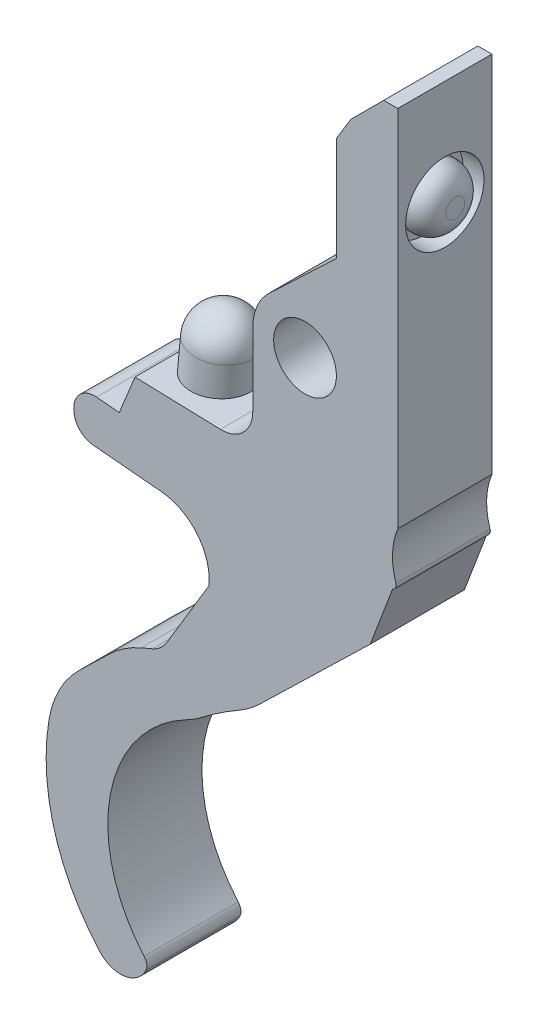
from build123d import *

# Parameters (mm, degrees)
SKETCH_1_R          = 5
SKETCH_1_R_2        = 3
EXTRUDE_1_DEPTH     = 9
SKETCH_2_R          = 3.75
CUT_EXTRUDE_1_DEPTH = 2
SKETCH_3_R          = 2.9
EXTRUDE_2_DEPTH     = 3
FILLET_1_R          = 2
SKETCH_4_R          = 2.9
EXTRUDE_3_DEPTH     = 10
FILLET_2_R          = 2.9
FILLET_3_R          = 3


with BuildPart() as part:
    # 스케치1 → 보스-돌출1 (new body)
    # profile 1 of 5: a face of its own
    with BuildSketch(Plane.XY):
        with BuildLine():
            Line((8.866410343, 21.94338903), (4.384187039, 21.94338903))
            Line((4.384187039, 21.94338903), (2.987768149, 19.65002342))
            Line((2.987768149, 19.65002342), (2.987768149, 17.661246793))
            Line((2.987768149, 17.661246793), (2.987768149, 9.70876495))
            Line((2.987768149, 9.70876495), (-3.184671245, 3.854590647))
            ThreePointArc((-3.184671245, 3.854590647), (2.13033375, 4.523458645), (5, 0))
            ThreePointArc((5, 0), (0, -5), (-5, 0))
            Line((-5, 0), (-5, -10.071407464))
            Line((-5, -10.071407464), (-16.264805165, -9.728236855))
            Line((-16.264805165, -9.728236855), (-17.766639728, -13.42657959))
            Line((-17.766639728, -13.42657959), (-19.940502755, -13.22881584))
            ThreePointArc((-19.940502755, -13.22881584), (-21.568981751, -13.840235901), (-22.102673306, -15.49581787))
            ThreePointArc((-22.102673306, -15.49581787), (-21.54079944, -16.765444299), (-20.287735083, -17.363343312))
            Line((-20.287735083, -17.363343312), (-13.716958703, -17.9611093))
            ThreePointArc((-13.716958703, -17.9611093), (-10.295562947, -19.77999502), (-9.201017746, -23.497018692))
            Line((-9.201017746, -23.497018692), (-13.218080179, -30.193463728))
            ThreePointArc((-13.218080179, -30.193463728), (-13.817495958, -30.9099569), (-14.608237914, -31.407338947))
            Line((-14.608237914, -31.407338947), (-15.680360182, -31.867141901))
            ThreePointArc((-15.680360182, -31.867141901), (-17.282818205, -32.73507756), (-18.70115036, -33.879419256))
            Line((-18.70115036, -33.879419256), (-21.587390027, -36.678865361))
            ThreePointArc((-21.587390027, -36.678865361), (-23.484754079, -39.219572782), (-24.491261067, -42.226585957))
            ThreePointArc((-24.491261067, -42.226585957), (-23.966473892, -51.146683639), (-19.652431958, -58.971808969))
            ThreePointArc((-19.652431958, -58.971808969), (-17.283591849, -59.850561763), (-15.231880476, -58.376082064))
            ThreePointArc((-15.231880476, -58.376082064), (-15.139015744, -57.789610004), (-15.395055283, -57.253870245))
            ThreePointArc((-15.395055283, -57.253870245), (-18.621303847, -45.462540141), (-11.334185384, -35.647141528))
            ThreePointArc((-11.334185384, -35.647141528), (-10.571184727, -35.206851872), (-9.849893086, -34.701121359))
            ThreePointArc((-9.849893086, -34.701121359), (-8.133553397, -33.471894478), (-6.337557558, -32.362291125))
            ThreePointArc((-6.337557558, -32.362291125), (-5.290911527, -31.673468731), (-4.338619501, -30.85916897))
            Line((-4.338619501, -30.85916897), (6.238088337, -20.600518625))
            Line((6.238088337, -20.600518625), (8.3701186, -14.978169718))
            ThreePointArc((8.3701186, -14.978169718), (8.662275884, -14.729272874), (8.69193724, -14.346616734))
            ThreePointArc((8.69193724, -14.346616734), (8.365752146, -12.021808556), (8.866410343, -9.728236855))
            Line((8.866410343, -9.728236855), (8.866410343, 21.94338903))
        make_face()
    # profile 2 of 5: a face of its own
    with BuildSketch(Plane.XY):
        Circle(SKETCH_1_R)
        Circle(SKETCH_1_R_2, mode=Mode.SUBTRACT)
    # profile 3 of 5: a face of its own
    with BuildSketch(Plane.XY):
        with BuildLine():
            ThreePointArc((5, 0), (2.13033375, 4.523458645), (-3.184671245, 3.854590647))
            ThreePointArc((-3.184671245, 3.854590647), (-4.523458645, 2.13033375), (-5, 0))
            ThreePointArc((-5, 0), (0, -5), (5, 0))
        make_face()
        Circle(SKETCH_1_R_2, mode=Mode.SUBTRACT)
    # profile 4 of 5: a face of its own
    with BuildSketch(Plane.XY):
        Polygon((8.866410343, 25.078081763), (7.518879772, 25.078081763), (4.384187039, 21.94338903), (8.866410343, 21.94338903), align=None)
    # profile 5 of 5: a face of its own
    with BuildSketch(Plane.XY):
        with BuildLine():
            Line((8.866410343, 21.94338903), (4.384187039, 21.94338903))
            Line((4.384187039, 21.94338903), (2.987768149, 19.65002342))
            Line((2.987768149, 19.65002342), (2.987768149, 17.661246793))
            Line((2.987768149, 17.661246793), (2.987768149, 9.70876495))
            Line((2.987768149, 9.70876495), (-3.184671245, 3.854590647))
            ThreePointArc((-3.184671245, 3.854590647), (2.13033375, 4.523458645), (5, 0))
            ThreePointArc((5, 0), (0, -5), (-5, 0))
            Line((-5, 0), (-5, -10.071407464))
            Line((-5, -10.071407464), (-16.264805165, -9.728236855))
            Line((-16.264805165, -9.728236855), (-17.766639728, -13.42657959))
            Line((-17.766639728, -13.42657959), (-19.940502755, -13.22881584))
            ThreePointArc((-19.940502755, -13.22881584), (-21.568981751, -13.840235901), (-22.102673306, -15.49581787))
            ThreePointArc((-22.102673306, -15.49581787), (-21.54079944, -16.765444299), (-20.287735083, -17.363343312))
            Line((-20.287735083, -17.363343312), (-13.716958703, -17.9611093))
            ThreePointArc((-13.716958703, -17.9611093), (-10.295562947, -19.77999502), (-9.201017746, -23.497018692))
            Line((-9.201017746, -23.497018692), (-13.218080179, -30.193463728))
            ThreePointArc((-13.218080179, -30.193463728), (-13.817495958, -30.9099569), (-14.608237914, -31.407338947))
            Line((-14.608237914, -31.407338947), (-15.680360182, -31.867141901))
            ThreePointArc((-15.680360182, -31.867141901), (-17.282818205, -32.73507756), (-18.70115036, -33.879419256))
            Line((-18.70115036, -33.879419256), (-21.587390027, -36.678865361))
            ThreePointArc((-21.587390027, -36.678865361), (-23.484754079, -39.219572782), (-24.491261067, -42.226585957))
            ThreePointArc((-24.491261067, -42.226585957), (-23.966473892, -51.146683639), (-19.652431958, -58.971808969))
            ThreePointArc((-19.652431958, -58.971808969), (-17.283591849, -59.850561763), (-15.231880476, -58.376082064))
            ThreePointArc((-15.231880476, -58.376082064), (-15.139015744, -57.789610004), (-15.395055283, -57.253870245))
            ThreePointArc((-15.395055283, -57.253870245), (-18.621303847, -45.462540141), (-11.334185384, -35.647141528))
            ThreePointArc((-11.334185384, -35.647141528), (-10.571184727, -35.206851872), (-9.849893086, -34.701121359))
            ThreePointArc((-9.849893086, -34.701121359), (-8.133553397, -33.471894478), (-6.337557558, -32.362291125))
            ThreePointArc((-6.337557558, -32.362291125), (-5.290911527, -31.673468731), (-4.338619501, -30.85916897))
            Line((-4.338619501, -30.85916897), (6.238088337, -20.600518625))
            Line((6.238088337, -20.600518625), (8.3701186, -14.978169718))
            ThreePointArc((8.3701186, -14.978169718), (8.662275884, -14.729272874), (8.69193724, -14.346616734))
            ThreePointArc((8.69193724, -14.346616734), (8.365752146, -12.021808556), (8.866410343, -9.728236855))
            Line((8.866410343, -9.728236855), (8.866410343, 21.94338903))
        make_face()
    extrude(amount=EXTRUDE_1_DEPTH)

    # 스케치2 → 컷-돌출1 (cut)
    with BuildSketch(Plane(origin=(8.866410343, 0, 0), x_dir=(0, 0, -1), z_dir=(1, 0, 0))):
        with Locations(Location((-4.5, 15.078081763, 0), (0, 0, 90))):
            Circle(SKETCH_2_R)
    extrude(amount=-CUT_EXTRUDE_1_DEPTH, mode=Mode.SUBTRACT)

    # 스케치3 → 보스-돌출2 (add)
    with BuildSketch(Plane(origin=(6.866410343, 0, 0), x_dir=(0, 0, -1), z_dir=(1, 0, 0))):
        with Locations(Location((-4.5, 15.078081763, 0), (0, 0, 90))):
            Circle(SKETCH_3_R)
    extrude(amount=EXTRUDE_2_DEPTH)

    # 필렛1
    fillet_1_edges = [part.edges().sort_by_distance(p)[0] for p in [
        (9.866410343, 12.178081763, 4.5),
    ]]
    fillet(fillet_1_edges, radius=FILLET_1_R)

    # 스케치4 → 보스-돌출3 (add)
    with BuildSketch(Plane(origin=(-1.357268469, -14.919396185, 0), x_dir=(0.995887428286197, -0.09059928355955607, 0), z_dir=(0.09059928355955607, 0.995887428286197, 0))):
        with Locations(Location((-11.65777439, -4.5, 0), (0, 0, 180))):
            Circle(SKETCH_4_R)
    extrude(amount=EXTRUDE_3_DEPTH)

    # 필렛2
    fillet_2_edges = [part.edges().sort_by_distance(p)[0] for p in [
        (-9.173033049, -4.167073817, 4.5),
    ]]
    fillet(fillet_2_edges, radius=FILLET_2_R)

    # 필렛3
    fillet_3_edges = [part.edges().sort_by_distance(p)[0] for p in [
        (-5, -10.071407464, 4.5),
    ]]
    fillet(fillet_3_edges, radius=FILLET_3_R)


solid = part.part
